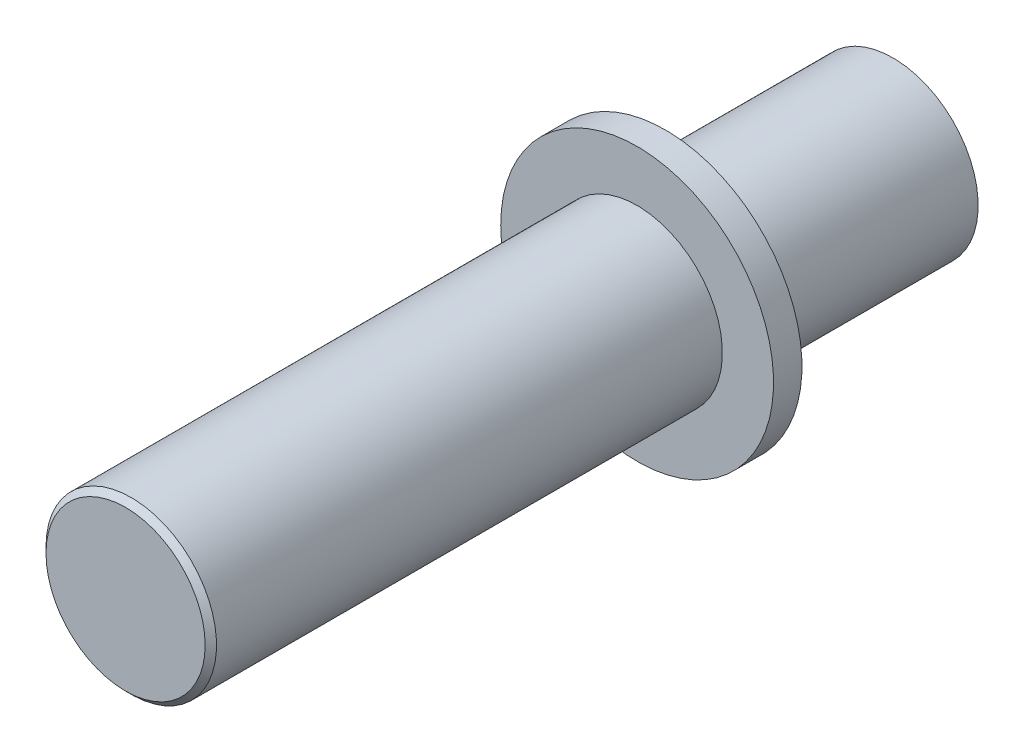
from build123d import *

# Parameters (mm, degrees)
SKETCH1_R           = 15
BOSS_EXTRUDE1_DEPTH = 90
SKETCH2_R           = 24
BOSS_EXTRUDE2_DEPTH = 5
CHAMFER1_SIZE       = 1
BOSS_EXTRUDE3_START = 40
SKETCH4_R           = 15
BOSS_EXTRUDE3_DEPTH = 40
CUT_EXTRUDE1_DEPTH  = 2
SKETCH6_R           = 8
CUT_EXTRUDE2_DEPTH  = 45


with BuildPart() as part:
    # Sketch1 → Boss-Extrude1 (new body)
    with BuildSketch(Plane.XY):
        Circle(SKETCH1_R)
    extrude(amount=BOSS_EXTRUDE1_DEPTH)

    # Sketch2 → Boss-Extrude2 (add)
    with BuildSketch(Plane(origin=(0, 0, 0), x_dir=(-1, 0, 0), z_dir=(0, 0, -1))):
        Circle(SKETCH2_R)
    extrude(amount=BOSS_EXTRUDE2_DEPTH)

    # Chamfer1
    chamfer1_edges = [part.edges().sort_by_distance(p)[0] for p in [
        (-15, 0, 90),
    ]]
    chamfer(chamfer1_edges, length=CHAMFER1_SIZE)

    # Sketch4 → Boss-Extrude3 (add)
    with BuildSketch(Plane(origin=(0, 0, -5), x_dir=(-1, 0, 0), z_dir=(0, 0, -1)).offset(BOSS_EXTRUDE3_START)):
        Circle(SKETCH4_R)
    extrude(amount=-BOSS_EXTRUDE3_DEPTH)

    # Sketch5 → Cut-Extrude1 (cut)
    with BuildSketch(Plane(origin=(-15, 0, -45), x_dir=(0, 0, -1), z_dir=(1, 0, 0))):
        with BuildLine():
            Line((-35, 3.284094305), (-10, 3.284094305))
            ThreePointArc((-10, 3.284094305), (-6.715905695, 0), (-10, -3.284094305))
            Line((-10, -3.284094305), (-35, -3.284094305))
            ThreePointArc((-35, -3.284094305), (-38.284094305, 0), (-35, 3.284094305))
        make_face()
    extrude(amount=CUT_EXTRUDE1_DEPTH, mode=Mode.SUBTRACT)

    # Sketch6 → Cut-Extrude2 (cut)
    with BuildSketch(Plane(origin=(0, 0, -45), x_dir=(-1, 0, 0), z_dir=(0, 0, -1))):
        Circle(SKETCH6_R)
    extrude(amount=-CUT_EXTRUDE2_DEPTH, mode=Mode.SUBTRACT)


solid = part.part
